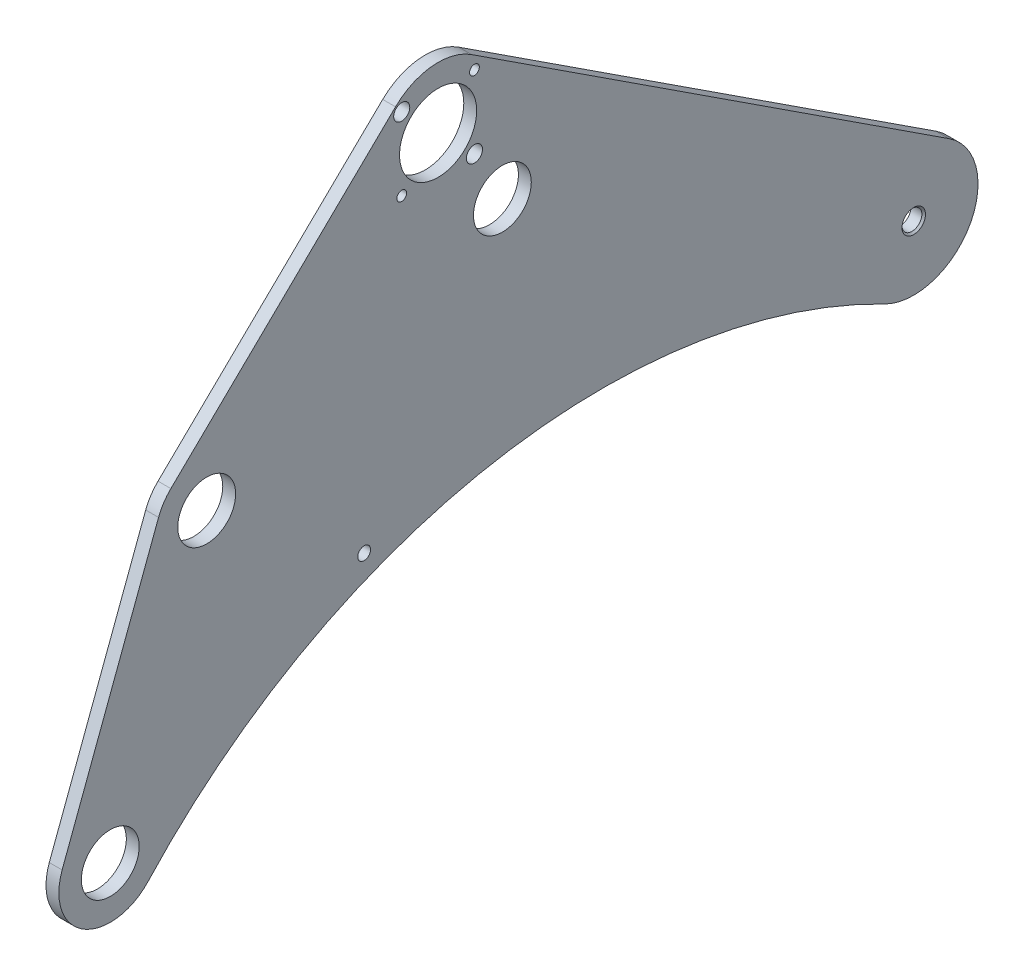
from build123d import *

# Parameters (mm, degrees)
BOSS_EXTRUDE1_DEPTH               = 6.35
CUT_EXTRUDE1_REACH                = 463.209
SKETCH3_R                         = 14.2875
SKETCH3_R_2                       = 19.05
SKETCH3_R_3                       = 2.413
SKETCH3_R_4                       = 3.96875
F_3_8_CLEARANCE_HOLE2_D           = 9.8044
F_3_8_CLEARANCE_HOLE2_CSINK_D     = 11.58748
F_3_8_CLEARANCE_HOLE2_CSINK_ANGLE = 90
F_1_4_0_2500_DOWEL_HOLE2_D        = 6.35


with BuildPart() as part:
    # Sketch2 → Boss-Extrude1 (new body)
    with BuildSketch(Plane(origin=(0, 0, 0), x_dir=(0, 0, -1), z_dir=(1, 0, 0))):
        with BuildLine():
            Line((-420.65776111, -67.281464584), (-373.03276111, 59.718535416))
            ThreePointArc((-373.03276111, 59.718535416), (-370.505449055, 64.705606261), (-366.948304567, 69.018946606))
            Line((-366.948304567, 69.018946606), (-255.966736674, 176.828999095))
            ThreePointArc((-255.966736674, 176.828999095), (-237.853043868, 185.216470627), (-218.467902472, 180.454975186))
            Line((-218.467902472, 180.454975186), (17.349576345, 26.590500195))
            ThreePointArc((17.349576345, 26.590500195), (27.457947121, -15.941255906), (-14.489671706, -28.250874568))
            ThreePointArc((-14.489671706, -28.250874568), (-207.31672278, 0.568286884), (-378.160809237, -93.373790032))
            ThreePointArc((-378.160809237, -93.373790032), (-410.165032474, -97.845670164), (-420.65776111, -67.281464584))
        make_face()
    extrude(amount=BOSS_EXTRUDE1_DEPTH)

    # Sketch3 → Cut-Extrude1 (cut, up to next)
    with BuildSketch(Plane(origin=(6.35, 0, 0), x_dir=(0, 0, -1), z_dir=(1, 0, 0)), mode=Mode.PRIVATE) as cut_extrude1_sk1:
        with Locations((-203.2, 111.125)):
            Circle(SKETCH3_R)
    cut_extrude1_tool1 = extrude(cut_extrude1_sk1.sketch, amount=-CUT_EXTRUDE1_REACH, mode=Mode.PRIVATE) & part.part
    # Sketch3 → Cut-Extrude1 (cut, up to next)
    with BuildSketch(Plane(origin=(6.35, 0, 0), x_dir=(0, 0, -1), z_dir=(1, 0, 0)), mode=Mode.PRIVATE) as cut_extrude1_sk2:
        with Locations((-349.25, 50.8)):
            Circle(SKETCH3_R)
    cut_extrude1_tool2 = extrude(cut_extrude1_sk2.sketch, amount=-CUT_EXTRUDE1_REACH, mode=Mode.PRIVATE) & part.part
    # Sketch3 → Cut-Extrude1 (cut, up to next)
    with BuildSketch(Plane(origin=(6.35, 0, 0), x_dir=(0, 0, -1), z_dir=(1, 0, 0)), mode=Mode.PRIVATE) as cut_extrude1_sk3:
        with Locations((-396.875, -76.2)):
            Circle(SKETCH3_R)
    cut_extrude1_tool3 = extrude(cut_extrude1_sk3.sketch, amount=-CUT_EXTRUDE1_REACH, mode=Mode.PRIVATE) & part.part
    # Sketch3 → Cut-Extrude1 (cut, up to next)
    with BuildSketch(Plane(origin=(6.35, 0, 0), x_dir=(0, 0, -1), z_dir=(1, 0, 0)), mode=Mode.PRIVATE) as cut_extrude1_sk4:
        with Locations((-234.95, 155.194)):
            Circle(SKETCH3_R_2)
    cut_extrude1_tool4 = extrude(cut_extrude1_sk4.sketch, amount=-CUT_EXTRUDE1_REACH, mode=Mode.PRIVATE) & part.part
    # Sketch3 → Cut-Extrude1 (cut, up to next)
    with BuildSketch(Plane(origin=(6.35, 0, 0), x_dir=(0, 0, -1), z_dir=(1, 0, 0)), mode=Mode.PRIVATE) as cut_extrude1_sk5:
        with Locations((-252.910512242, 137.233487758)):
            Circle(SKETCH3_R_3)
    cut_extrude1_tool5 = extrude(cut_extrude1_sk5.sketch, amount=-CUT_EXTRUDE1_REACH, mode=Mode.PRIVATE) & part.part
    # Sketch3 → Cut-Extrude1 (cut, up to next)
    with BuildSketch(Plane(origin=(6.35, 0, 0), x_dir=(0, 0, -1), z_dir=(1, 0, 0)), mode=Mode.PRIVATE) as cut_extrude1_sk6:
        with Locations((-216.989487758, 137.233487758)):
            Circle(SKETCH3_R_4)
    cut_extrude1_tool6 = extrude(cut_extrude1_sk6.sketch, amount=-CUT_EXTRUDE1_REACH, mode=Mode.PRIVATE) & part.part
    # Sketch3 → Cut-Extrude1 (cut, up to next)
    with BuildSketch(Plane(origin=(6.35, 0, 0), x_dir=(0, 0, -1), z_dir=(1, 0, 0)), mode=Mode.PRIVATE) as cut_extrude1_sk7:
        with Locations((-216.989487758, 173.154512242)):
            Circle(SKETCH3_R_3)
    cut_extrude1_tool7 = extrude(cut_extrude1_sk7.sketch, amount=-CUT_EXTRUDE1_REACH, mode=Mode.PRIVATE) & part.part
    # Sketch3 → Cut-Extrude1 (cut, up to next)
    with BuildSketch(Plane(origin=(6.35, 0, 0), x_dir=(0, 0, -1), z_dir=(1, 0, 0)), mode=Mode.PRIVATE) as cut_extrude1_sk8:
        with Locations((-252.910512242, 173.154512242)):
            Circle(SKETCH3_R_4)
    cut_extrude1_tool8 = extrude(cut_extrude1_sk8.sketch, amount=-CUT_EXTRUDE1_REACH, mode=Mode.PRIVATE) & part.part
    add(cut_extrude1_tool1.solids().sort_by_distance((6.35, 111.125, 203.2))[0], mode=Mode.SUBTRACT)
    add(cut_extrude1_tool2.solids().sort_by_distance((6.35, 50.8, 349.25))[0], mode=Mode.SUBTRACT)
    add(cut_extrude1_tool3.solids().sort_by_distance((6.35, -76.2, 396.875))[0], mode=Mode.SUBTRACT)
    add(cut_extrude1_tool4.solids().sort_by_distance((6.35, 155.194, 234.95))[0], mode=Mode.SUBTRACT)
    add(cut_extrude1_tool5.solids().sort_by_distance((6.35, 137.233488, 252.910512))[0], mode=Mode.SUBTRACT)
    add(cut_extrude1_tool6.solids().sort_by_distance((6.35, 137.233488, 216.989488))[0], mode=Mode.SUBTRACT)
    add(cut_extrude1_tool7.solids().sort_by_distance((6.35, 173.154512, 216.989488))[0], mode=Mode.SUBTRACT)
    add(cut_extrude1_tool8.solids().sort_by_distance((6.35, 173.154512, 252.910512))[0], mode=Mode.SUBTRACT)

    # 3/8 Clearance Hole2 (through all)
    with Locations(Plane(origin=(6.35, 0, 0), x_dir=(0, 0, -1), z_dir=(1, 0, 0))):
        with Locations((0, 0)):
            CounterSinkHole(F_3_8_CLEARANCE_HOLE2_D / 2, F_3_8_CLEARANCE_HOLE2_CSINK_D / 2, counter_sink_angle=F_3_8_CLEARANCE_HOLE2_CSINK_ANGLE)

    # 1/4 (0.2500) Dowel Hole2 (through all)
    with Locations(Plane(origin=(6.35, 0, 0), x_dir=(0, 0, -1), z_dir=(1, 0, 0))):
        with Locations((-271.4625, -6.35)):
            Hole(F_1_4_0_2500_DOWEL_HOLE2_D / 2)


solid = part.part
